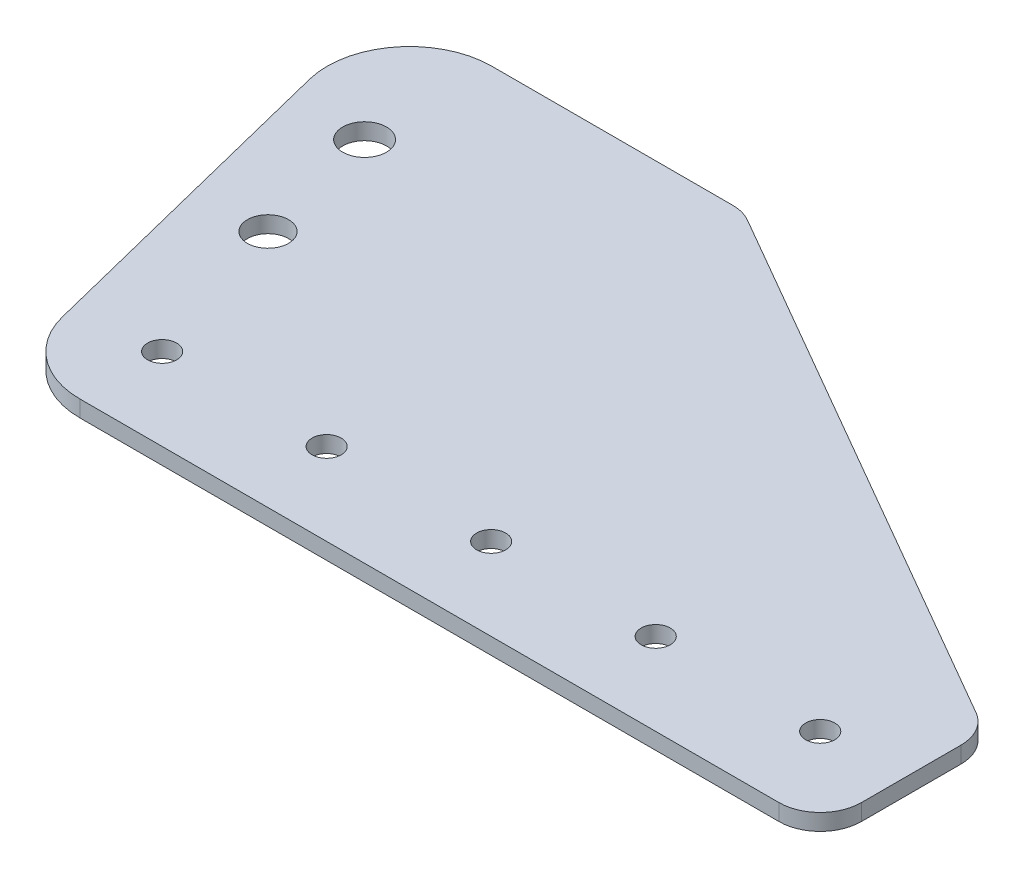
from build123d import *

# Parameters (mm, degrees)
BOSS_EXTRUDE1_DEPTH     = 2.54
F_1_4_CLEARANCE_HOLE1_D = 6.7564
F_8_CLEARANCE_HOLE3_D   = 4.4958
FILLET1_R               = 6.35
SKETCH14_R              = 3.175
CUT_EXTRUDE1_DEPTH      = 2.54


with BuildPart() as part:
    # Sketch1 → Boss-Extrude1 (new body)
    with BuildSketch(Plane(origin=(0, 0, 0), x_dir=(1, 0, 0), z_dir=(0, 1, 0))):
        with BuildLine():
            Line((127, -12.7), (12.7, -12.7))
            ThreePointArc((12.7, -12.7), (4.882201751, -10.008597831), (0.377921481, -3.07512292))
            Line((0.377921481, -3.07512292), (-12.322078519, 47.81402892))
            ThreePointArc((-12.322078519, 47.81402892), (-10.008597831, 58.706950088), (0, 63.58915184))
            Line((0, 63.58915184), (38.85740346, 63.58915184))
            Line((38.85740346, 63.58915184), (127, 12.7))
            Line((127, 12.7), (127, -12.7))
        make_face()
    extrude(amount=BOSS_EXTRUDE1_DEPTH)

    # 1/4 Clearance Hole1 (through all)
    with Locations(Plane(origin=(0, 2.54, 0), x_dir=(1, 0, 0), z_dir=(0, 1, 0))):
        with Locations((0, 43.956848345)):
            Hole(F_1_4_CLEARANCE_HOLE1_D / 2)

    # #8 Clearance Hole3 (through all)
    with Locations(Plane(origin=(0, 2.54, 0), x_dir=(1, 0, 0), z_dir=(0, 1, 0))):
        with Locations((12.7, 0), (38.1, 0), (63.5, 0), (88.9, 0), (114.3, 0)):
            Hole(F_8_CLEARANCE_HOLE3_D / 2)

    # Fillet1
    fillet1_edges = [part.edges().sort_by_distance(p)[0] for p in [
        (127, 1.27, 12.7),
        (38.85740346, 1.27, -63.58915184),
        (127, 1.27, -12.7),
    ]]
    fillet(fillet1_edges, radius=FILLET1_R)

    # Sketch14 → Cut-Extrude1 (cut)
    with BuildSketch(Plane(origin=(0, 2.54, 0), x_dir=(1, 0, 0), z_dir=(0, 1, 0))):
        with Locations(Location((4.83277957, 24.209700029, 0), (0, 0, 270))):
            Circle(SKETCH14_R)
    extrude(amount=-CUT_EXTRUDE1_DEPTH, mode=Mode.SUBTRACT)


solid = part.part
